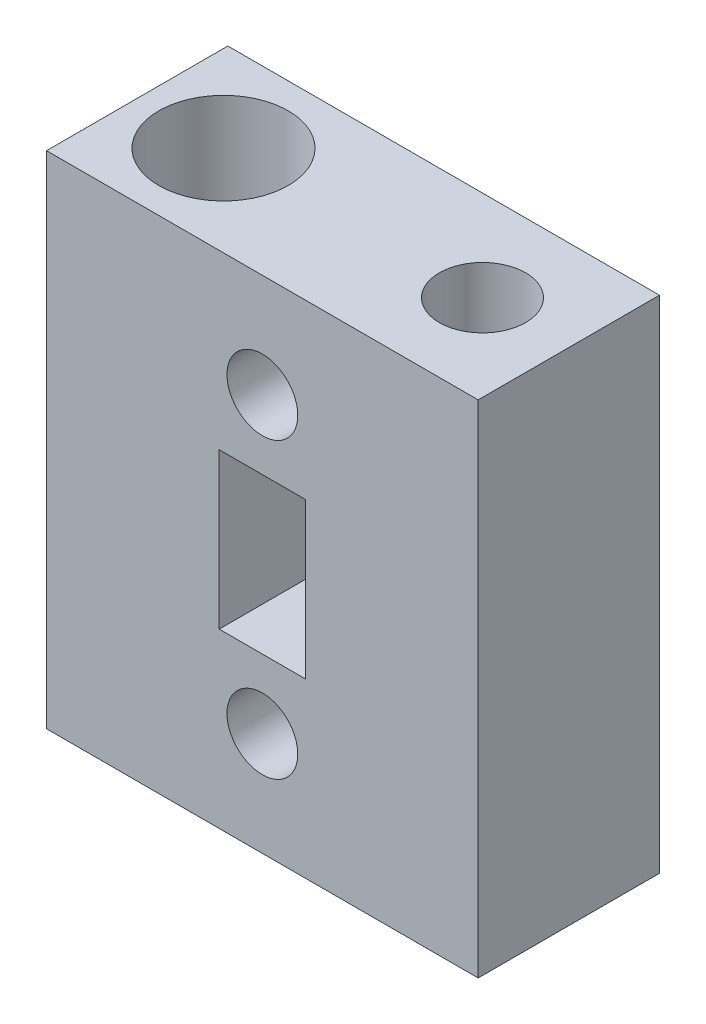
from build123d import *

# Parameters (mm, degrees)
SKETCH1_W           = 50
SKETCH1_H           = 21
BOSS_EXTRUDE1_DEPTH = 58
SKETCH3_R           = 7.5
CUT_EXTRUDE1_DEPTH  = 24
CUT_EXTRUDE2_REACH  = 66.025
SKETCH4_R           = 5
CUT_EXTRUDE3_START  = -24
SKETCH5_R           = 7.5
CUT_EXTRUDE3_DEPTH  = 24
CUT_EXTRUDE4_REACH  = 66.025
SKETCH6_R           = 4.5
CUT_EXTRUDE5_REACH  = 68.558
SKETCH8_W           = 10
SKETCH8_H           = 18
SKETCH7_R           = 4.1
CUT_EXTRUDE6_DEPTH  = 15


with BuildPart() as part:
    # Sketch1 → Boss-Extrude1 (new body)
    with BuildSketch(Plane(origin=(0, 0, 0), x_dir=(1, 0, 0), z_dir=(0, 1, 0))):
        Rectangle(SKETCH1_W, SKETCH1_H)
    extrude(amount=BOSS_EXTRUDE1_DEPTH)

    # Sketch3 → Cut-Extrude1 (cut)
    with BuildSketch(Plane(origin=(0, 58, 0), x_dir=(1, 0, 0), z_dir=(0, 1, 0))):
        with Locations(Location((-15, 0, 0), (0, 0, 270))):
            Circle(SKETCH3_R)
    extrude(amount=-CUT_EXTRUDE1_DEPTH, mode=Mode.SUBTRACT)

    # Sketch4 → Cut-Extrude2 (cut, up to next)
    with BuildSketch(Plane(origin=(0, 58, 0), x_dir=(1, 0, 0), z_dir=(0, 1, 0)), mode=Mode.PRIVATE) as cut_extrude2_sk1:
        with Locations(Location((15, 0, 0), (0, 0, 270))):
            Circle(SKETCH4_R)
    cut_extrude2_tool1 = extrude(cut_extrude2_sk1.sketch, amount=-CUT_EXTRUDE2_REACH, mode=Mode.PRIVATE) & part.part
    add(cut_extrude2_tool1.solids().sort_by_distance((15, 58, 0))[0], mode=Mode.SUBTRACT)

    # Sketch5 → Cut-Extrude3 (cut)
    with BuildSketch(Plane.XZ.offset(CUT_EXTRUDE3_START)):
        with Locations(Location((-15, 0, 0), (0, 0, 90))):
            Circle(SKETCH5_R)
    extrude(amount=CUT_EXTRUDE3_DEPTH, mode=Mode.SUBTRACT)

    # Sketch6 → Cut-Extrude4 (cut, up to next)
    with BuildSketch(Plane.XZ, mode=Mode.PRIVATE) as cut_extrude4_sk1:
        with Locations(Location((-15, 0, 0), (0, 0, 270))):
            Circle(SKETCH6_R)
    cut_extrude4_tool1 = extrude(cut_extrude4_sk1.sketch, amount=-CUT_EXTRUDE4_REACH, mode=Mode.PRIVATE) & part.part
    add(cut_extrude4_tool1.solids().sort_by_distance((-15, 0, 0))[0], mode=Mode.SUBTRACT)

    # Sketch8 → Cut-Extrude5 (cut, up to next)
    with BuildSketch(Plane.XY.offset(10.5), mode=Mode.PRIVATE) as cut_extrude5_sk1:
        with Locations((0, 29)):
            Rectangle(SKETCH8_W, SKETCH8_H)
    cut_extrude5_tool1 = extrude(cut_extrude5_sk1.sketch, amount=-CUT_EXTRUDE5_REACH, mode=Mode.PRIVATE) & part.part
    add(cut_extrude5_tool1.solids().sort_by_distance((0, 29, 10.5))[0], mode=Mode.SUBTRACT)

    # Sketch7 → Cut-Extrude6 (cut)
    with BuildSketch(Plane.XY.offset(10.5)):
        with Locations((0, 46)):
            Circle(SKETCH7_R)
        with Locations(Location((0, 12, 0), (0, 0, 180))):
            Circle(SKETCH7_R)
    extrude(amount=-CUT_EXTRUDE6_DEPTH, mode=Mode.SUBTRACT)


solid = part.part
